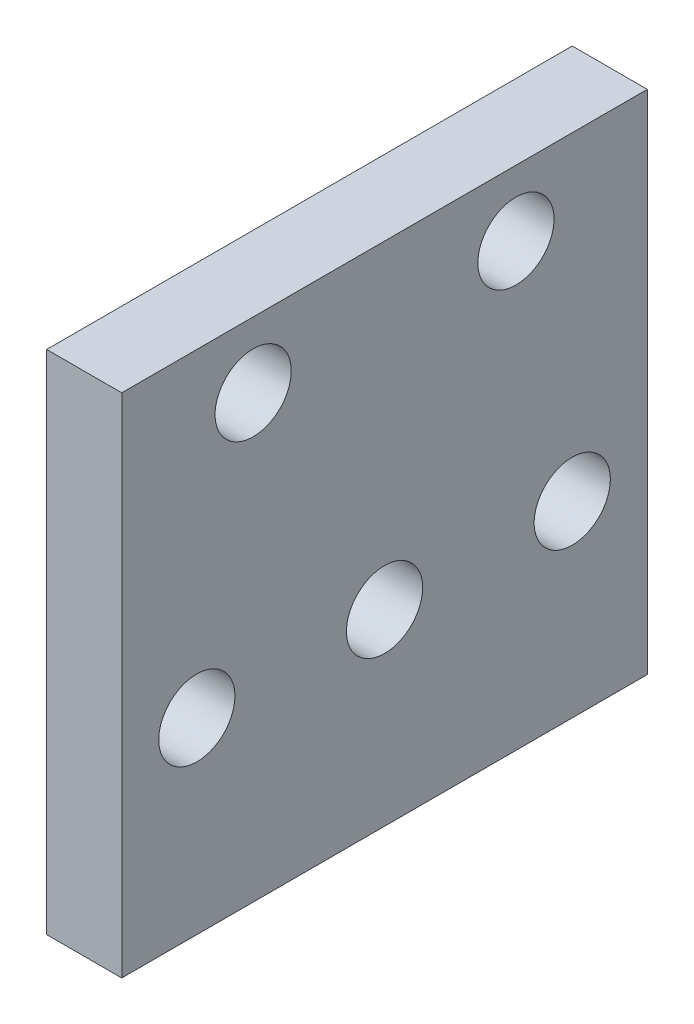
from build123d import *

# Parameters (mm, degrees)
SKETCH1_W           = 35.56
SKETCH1_H           = 34.29
BOSS_EXTRUDE1_DEPTH = 5.08
SKETCH2_R           = 2.5781
CUT_EXTRUDE1_DEPTH  = 26.216776658


with BuildPart() as part:
    # Sketch1 → Boss-Extrude1 (new body)
    with BuildSketch(Plane(origin=(0, 0, 0), x_dir=(0, 0, -1), z_dir=(1, 0, 0))):
        Rectangle(SKETCH1_W, SKETCH1_H)
    extrude(amount=BOSS_EXTRUDE1_DEPTH)

    # Sketch2 → Cut-Extrude1 (cut, through all)
    with BuildSketch(Plane(origin=(5.08, 0, 0), x_dir=(0, 0, -1), z_dir=(1, 0, 0))):
        with Locations((-8.89, 12.7)):
            Circle(SKETCH2_R)
        with Locations((8.89, 12.7)):
            Circle(SKETCH2_R)
        with Locations((-12.7, -4.445)):
            Circle(SKETCH2_R)
        with Locations((0, -4.445)):
            Circle(SKETCH2_R)
        with Locations((12.7, -4.445)):
            Circle(SKETCH2_R)
    extrude(amount=-CUT_EXTRUDE1_DEPTH, mode=Mode.SUBTRACT)


solid = part.part
